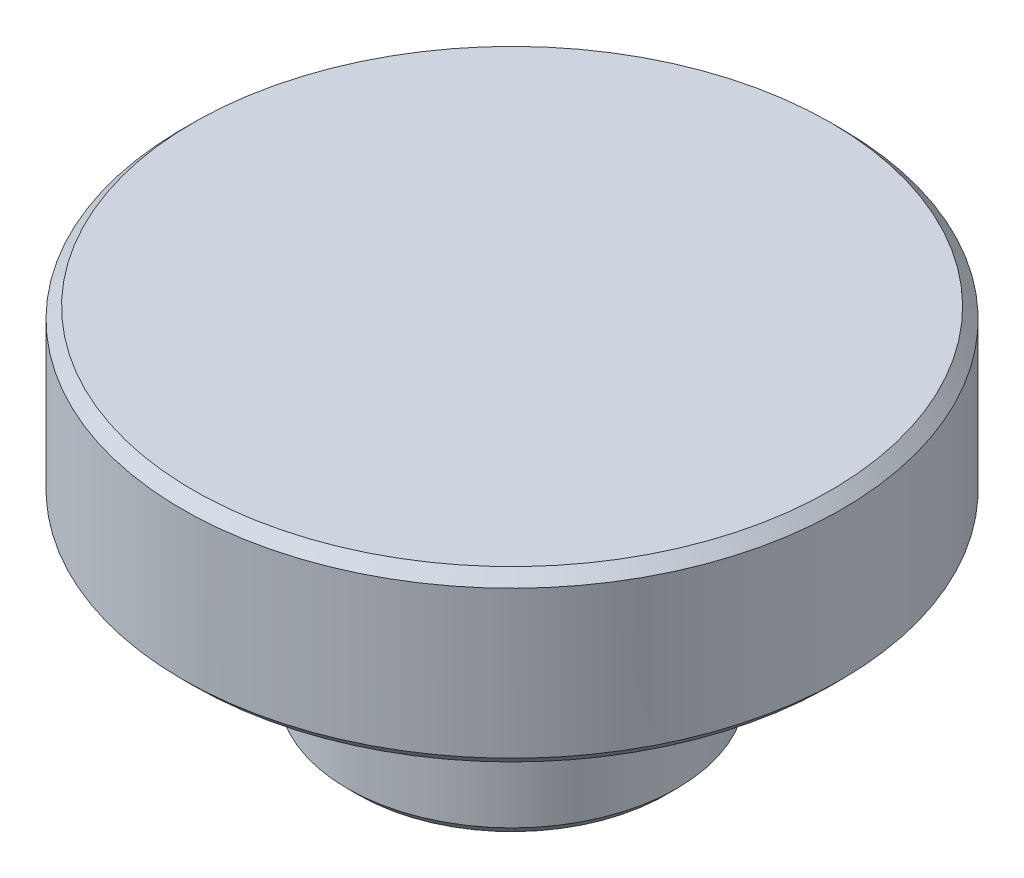
from build123d import *

# Parameters (mm, degrees)
CHAMFER1_SIZE      = 0.5
SKETCH2_R          = 1
CUT_EXTRUDE1_DEPTH = 27.420872431


with BuildPart() as part:
    # Sketch1 → Revolve1 (revolve)
    with BuildSketch(Plane.XY):
        Polygon((0, 15.75), (-15, 15.75), (-15, 8.05), (-7.5, 8.05), (-7.5, 0), (-2.5, 0), (-2.5, 10), (0, 10), align=None)
    revolve(axis=Axis((0, 0, 0), (0, 1, 0)))

    # Chamfer1
    chamfer1_edges = [part.edges().sort_by_distance(p)[0] for p in [
        (7.5, 0, 0),
        (7.5, 8.05, 0),
        (15, 8.05, 0),
        (15, 15.75, 0),
    ]]
    chamfer(chamfer1_edges, length=CHAMFER1_SIZE)

    # Sketch2 → Cut-Extrude1 (cut, through all)
    with BuildSketch(Plane.XY):
        with Locations((0, 4.5)):
            Circle(SKETCH2_R)
    extrude(amount=-CUT_EXTRUDE1_DEPTH, mode=Mode.SUBTRACT)


solid = part.part
